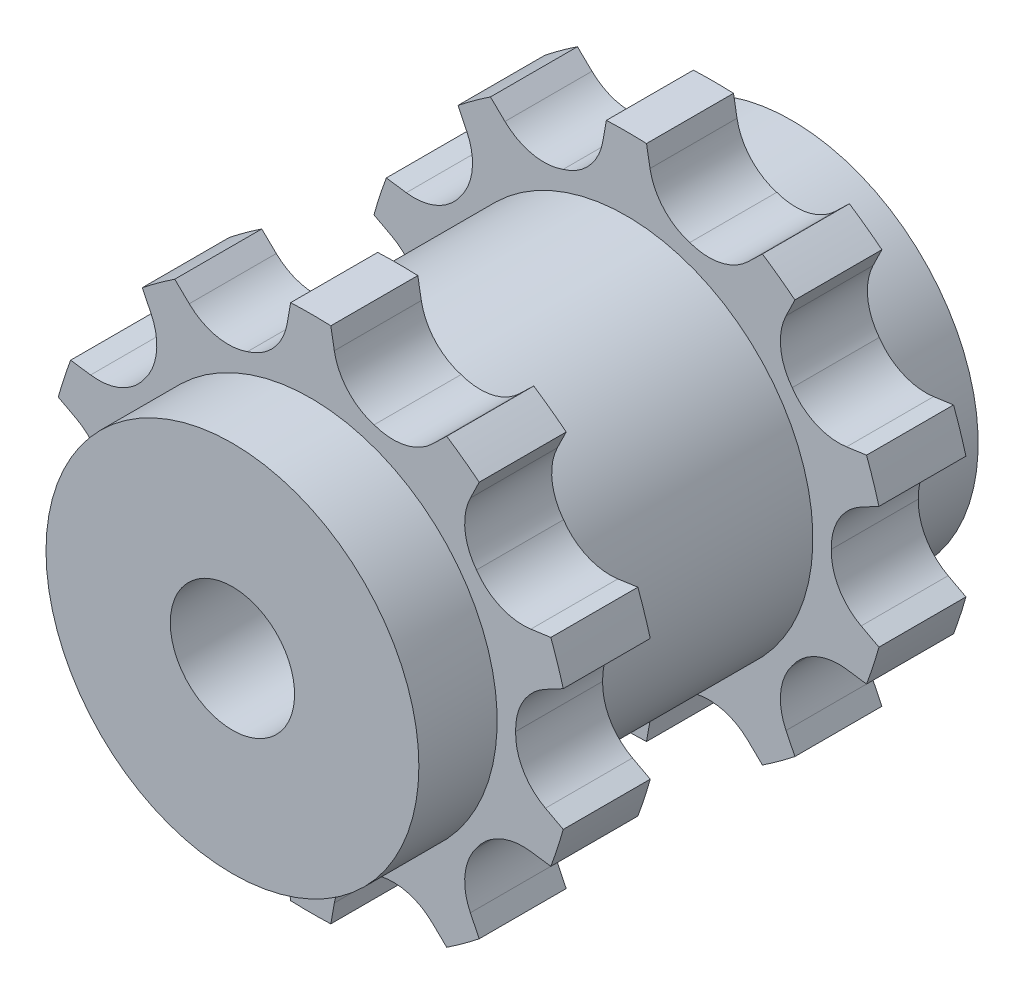
from build123d import *

# Parameters (mm, degrees)
EXTRUDE_1_DEPTH     = 7
SKETCH_2_R          = 15
EXTRUDE_2_DEPTH     = 18.4
EXTRUDE_3_DEPTH     = 7
EXTRUDE_START       = 6.3
SKETCH_4_R          = 15
EXTRUDE_4_DEPTH     = 6.3
SKETCH_5_R          = 15
EXTRUDE_5_DEPTH     = 6.3
SKETCH_6_R          = 5
CUT_EXTRUDE_1_DEPTH = 90.291681756


with BuildPart() as part:
    # 草图1 → 凸台-拉伸1 (new body)
    with BuildSketch(Plane.XY.offset(28.9)):
        with BuildLine():
            Line((42.411201909, 45.77806603), (42.129389286, 47.376304833))
            ThreePointArc((42.129389286, 47.376304833), (40.514502568, 47.409839327), (38.89961585, 47.376304833))
            Line((38.89961585, 47.376304833), (38.617803227, 45.77806603))
            ThreePointArc((38.617803227, 45.77806603), (37.528159676, 43.541003491), (35.420005537, 42.219088972))
            ThreePointArc((35.420005537, 42.219088972), (32.937471152, 42.04939837), (30.741018632, 43.218743572))
            Line((30.741018632, 43.218743572), (29.573606233, 44.346100621))
            ThreePointArc((29.573606233, 44.346100621), (28.247424353, 43.424024), (26.960664635, 42.447687427))
            Line((26.960664635, 42.447687427), (27.672094632, 40.98903977))
            ThreePointArc((27.672094632, 40.98903977), (28.10546685, 38.538741749), (27.176936184, 36.230148526))
            ThreePointArc((27.176936184, 36.230148526), (25.268265311, 34.633668845), (22.80397403, 34.288646587))
            Line((22.80397403, 34.288646587), (21.196873713, 34.514509808))
            ThreePointArc((21.196873713, 34.514509808), (20.665953073, 32.989024), (20.198818833, 31.442812735))
            Line((20.198818833, 31.442812735), (21.631749371, 30.680910052))
            ThreePointArc((21.631749371, 30.680910052), (23.422603901, 28.95330711), (24.028363863, 26.539839327))
            ThreePointArc((24.028363863, 26.539839327), (23.422603901, 24.126371544), (21.631749371, 22.398768602))
            Line((21.631749371, 22.398768602), (20.198818833, 21.63686592))
            ThreePointArc((20.198818833, 21.63686592), (20.665953073, 20.090654655), (21.196873713, 18.565168847))
            Line((21.196873713, 18.565168847), (22.80397403, 18.791032067))
            ThreePointArc((22.80397403, 18.791032067), (25.268265311, 18.446009809), (27.176936184, 16.849530129))
            ThreePointArc((27.176936184, 16.849530129), (28.10546685, 14.540936905), (27.672094632, 12.090638884))
            Line((27.672094632, 12.090638884), (26.960664635, 10.631991228))
            ThreePointArc((26.960664635, 10.631991228), (28.247424353, 9.655654655), (29.573606233, 8.733578033))
            Line((29.573606233, 8.733578033), (30.741018632, 9.860935083))
            ThreePointArc((30.741018632, 9.860935083), (32.937471152, 11.030280285), (35.420005536, 10.860589683))
            ThreePointArc((35.420005536, 10.860589683), (37.528159676, 9.538675164), (38.617803227, 7.301612625))
            Line((38.617803227, 7.301612625), (38.89961585, 5.703373822))
            ThreePointArc((38.89961585, 5.703373822), (40.514502568, 5.669839327), (42.129389286, 5.703373822))
            Line((42.129389286, 5.703373822), (42.411201909, 7.301612625))
            ThreePointArc((42.411201909, 7.301612625), (43.50084546, 9.538675164), (45.6089996, 10.860589683))
            ThreePointArc((45.6089996, 10.860589683), (48.091533984, 11.030280285), (50.287986504, 9.860935083))
            Line((50.287986504, 9.860935083), (51.455398903, 8.733578033))
            ThreePointArc((51.455398903, 8.733578033), (52.781580783, 9.655654655), (54.068340501, 10.631991228))
            Line((54.068340501, 10.631991228), (53.356910504, 12.090638884))
            ThreePointArc((53.356910504, 12.090638884), (52.923538286, 14.540936905), (53.852068952, 16.849530129))
            ThreePointArc((53.852068952, 16.849530129), (55.760739826, 18.446009809), (58.225031106, 18.791032067))
            Line((58.225031106, 18.791032067), (59.832131424, 18.565168847))
            ThreePointArc((59.832131424, 18.565168847), (60.363052063, 20.090654655), (60.830186304, 21.63686592))
            Line((60.830186304, 21.63686592), (59.397255765, 22.398768602))
            ThreePointArc((59.397255765, 22.398768602), (57.606401235, 24.126371544), (57.000641274, 26.539839327))
            ThreePointArc((57.000641274, 26.539839327), (57.606401235, 28.95330711), (59.397255765, 30.680910052))
            Line((59.397255765, 30.680910052), (60.830186304, 31.442812735))
            ThreePointArc((60.830186304, 31.442812735), (60.363052063, 32.989024), (59.832131424, 34.514509808))
            Line((59.832131424, 34.514509808), (58.225031106, 34.288646587))
            ThreePointArc((58.225031106, 34.288646587), (55.760739826, 34.633668845), (53.852068952, 36.230148526))
            ThreePointArc((53.852068952, 36.230148526), (52.923538286, 38.538741749), (53.356910504, 40.98903977))
            Line((53.356910504, 40.98903977), (54.068340501, 42.447687427))
            ThreePointArc((54.068340501, 42.447687427), (52.781580783, 43.424024), (51.455398903, 44.346100621))
            Line((51.455398903, 44.346100621), (50.287986504, 43.218743572))
            ThreePointArc((50.287986504, 43.218743572), (48.091533984, 42.04939837), (45.6089996, 42.219088972))
            ThreePointArc((45.6089996, 42.219088972), (43.50084546, 43.541003491), (42.411201909, 45.77806603))
        make_face()
    extrude(amount=-EXTRUDE_1_DEPTH)

    # 草图2 → 凸台-拉伸2 (add)
    with BuildSketch(Plane(origin=(0, 0, 21.9), x_dir=(-1, 0, 0), z_dir=(0, 0, -1))):
        with Locations((-40.514502568, 26.539839327)):
            Circle(SKETCH_2_R)
    extrude(amount=EXTRUDE_2_DEPTH)

    # 草图3 → 凸台-拉伸3 (add)
    with BuildSketch(Plane.XY.offset(3.5)):
        with BuildLine():
            Line((42.411201909, 45.77806603), (42.129389286, 47.376304833))
            ThreePointArc((42.129389286, 47.376304833), (40.514502568, 47.409839327), (38.89961585, 47.376304833))
            Line((38.89961585, 47.376304833), (38.617803227, 45.77806603))
            ThreePointArc((38.617803227, 45.77806603), (37.528159676, 43.541003491), (35.420005537, 42.219088972))
            ThreePointArc((35.420005537, 42.219088972), (32.937471152, 42.04939837), (30.741018632, 43.218743572))
            Line((30.741018632, 43.218743572), (29.573606233, 44.346100621))
            ThreePointArc((29.573606233, 44.346100621), (28.247424353, 43.424024), (26.960664635, 42.447687427))
            Line((26.960664635, 42.447687427), (27.672094632, 40.98903977))
            ThreePointArc((27.672094632, 40.98903977), (28.10546685, 38.538741749), (27.176936184, 36.230148526))
            ThreePointArc((27.176936184, 36.230148526), (25.268265311, 34.633668845), (22.80397403, 34.288646587))
            Line((22.80397403, 34.288646587), (21.196873713, 34.514509808))
            ThreePointArc((21.196873713, 34.514509808), (20.665953073, 32.989024), (20.198818833, 31.442812735))
            Line((20.198818833, 31.442812735), (21.631749371, 30.680910052))
            ThreePointArc((21.631749371, 30.680910052), (23.422603901, 28.95330711), (24.028363863, 26.539839327))
            ThreePointArc((24.028363863, 26.539839327), (23.422603901, 24.126371544), (21.631749371, 22.398768602))
            Line((21.631749371, 22.398768602), (20.198818833, 21.63686592))
            ThreePointArc((20.198818833, 21.63686592), (20.665953073, 20.090654655), (21.196873713, 18.565168847))
            Line((21.196873713, 18.565168847), (22.80397403, 18.791032067))
            ThreePointArc((22.80397403, 18.791032067), (25.268265311, 18.446009809), (27.176936184, 16.849530129))
            ThreePointArc((27.176936184, 16.849530129), (28.10546685, 14.540936905), (27.672094632, 12.090638884))
            Line((27.672094632, 12.090638884), (26.960664635, 10.631991228))
            ThreePointArc((26.960664635, 10.631991228), (28.247424353, 9.655654655), (29.573606233, 8.733578033))
            Line((29.573606233, 8.733578033), (30.741018632, 9.860935083))
            ThreePointArc((30.741018632, 9.860935083), (32.937471152, 11.030280285), (35.420005536, 10.860589683))
            ThreePointArc((35.420005536, 10.860589683), (37.528159676, 9.538675164), (38.617803227, 7.301612625))
            Line((38.617803227, 7.301612625), (38.89961585, 5.703373822))
            ThreePointArc((38.89961585, 5.703373822), (40.514502568, 5.669839327), (42.129389286, 5.703373822))
            Line((42.129389286, 5.703373822), (42.411201909, 7.301612625))
            ThreePointArc((42.411201909, 7.301612625), (43.50084546, 9.538675164), (45.6089996, 10.860589683))
            ThreePointArc((45.6089996, 10.860589683), (48.091533984, 11.030280285), (50.287986504, 9.860935083))
            Line((50.287986504, 9.860935083), (51.455398903, 8.733578033))
            ThreePointArc((51.455398903, 8.733578033), (52.781580783, 9.655654655), (54.068340501, 10.631991228))
            Line((54.068340501, 10.631991228), (53.356910504, 12.090638884))
            ThreePointArc((53.356910504, 12.090638884), (52.923538286, 14.540936905), (53.852068952, 16.849530129))
            ThreePointArc((53.852068952, 16.849530129), (55.760739826, 18.446009809), (58.225031106, 18.791032067))
            Line((58.225031106, 18.791032067), (59.832131424, 18.565168847))
            ThreePointArc((59.832131424, 18.565168847), (60.363052063, 20.090654655), (60.830186304, 21.63686592))
            Line((60.830186304, 21.63686592), (59.397255765, 22.398768602))
            ThreePointArc((59.397255765, 22.398768602), (57.606401235, 24.126371544), (57.000641274, 26.539839327))
            ThreePointArc((57.000641274, 26.539839327), (57.606401235, 28.95330711), (59.397255765, 30.680910052))
            Line((59.397255765, 30.680910052), (60.830186304, 31.442812735))
            ThreePointArc((60.830186304, 31.442812735), (60.363052063, 32.989024), (59.832131424, 34.514509808))
            Line((59.832131424, 34.514509808), (58.225031106, 34.288646587))
            ThreePointArc((58.225031106, 34.288646587), (55.760739826, 34.633668845), (53.852068952, 36.230148526))
            ThreePointArc((53.852068952, 36.230148526), (52.923538286, 38.538741749), (53.356910504, 40.98903977))
            Line((53.356910504, 40.98903977), (54.068340501, 42.447687427))
            ThreePointArc((54.068340501, 42.447687427), (52.781580783, 43.424024), (51.455398903, 44.346100621))
            Line((51.455398903, 44.346100621), (50.287986504, 43.218743572))
            ThreePointArc((50.287986504, 43.218743572), (48.091533984, 42.04939837), (45.6089996, 42.219088972))
            ThreePointArc((45.6089996, 42.219088972), (43.50084546, 43.541003491), (42.411201909, 45.77806603))
        make_face()
    extrude(amount=-EXTRUDE_3_DEPTH)

    # 草图4 → 凸台-拉伸4 (add)
    with BuildSketch(Plane.XY.offset(28.9).offset(EXTRUDE_START)):
        with Locations(Location((40.514502568, 26.539839327, 0), (0, 0, 180))):
            Circle(SKETCH_4_R)
    extrude(amount=-EXTRUDE_4_DEPTH)

    # 草图5 → 凸台-拉伸5 (add)
    with BuildSketch(Plane(origin=(0, 0, -3.5), x_dir=(-1, 0, 0), z_dir=(0, 0, -1))):
        with Locations((-40.514502568, 26.539839327)):
            Circle(SKETCH_5_R)
    extrude(amount=EXTRUDE_5_DEPTH)

    # 草图6 → 切除-拉伸1 (cut, through all)
    with BuildSketch(Plane(origin=(0, 0, -9.8), x_dir=(-1, 0, 0), z_dir=(0, 0, -1))):
        with Locations((-40.514502568, 26.539839327)):
            Circle(SKETCH_6_R)
    extrude(amount=-CUT_EXTRUDE_1_DEPTH, mode=Mode.SUBTRACT)


solid = part.part
